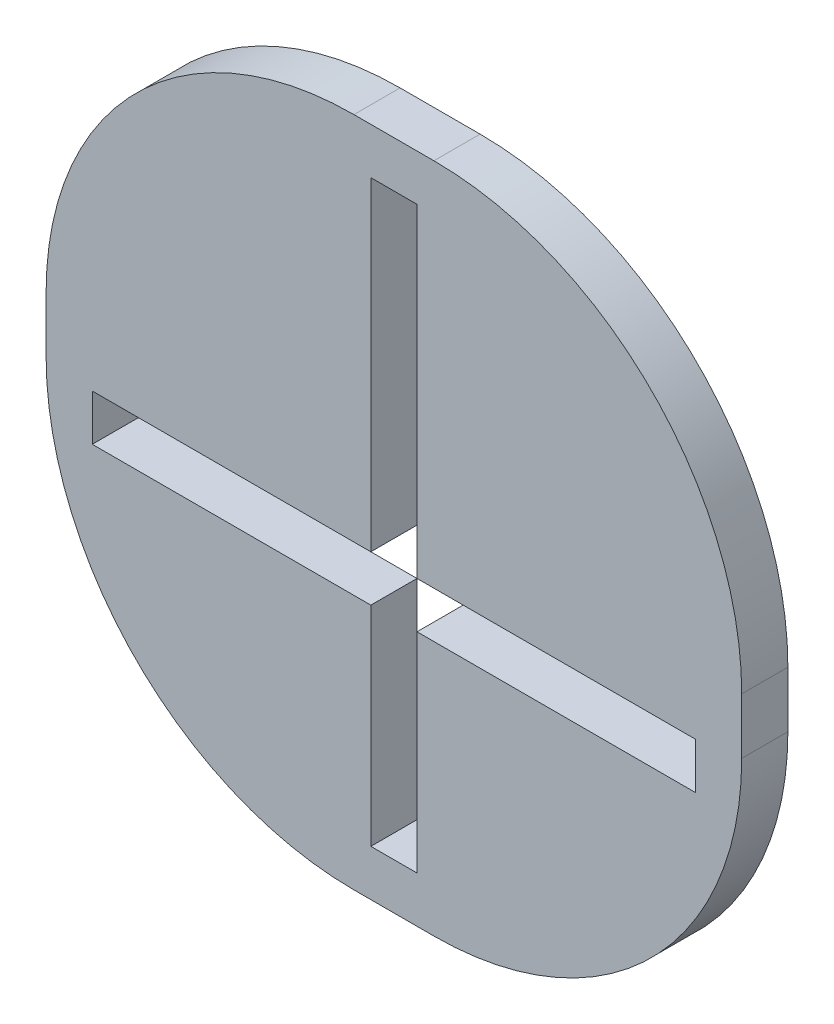
from build123d import *

# Parameters (mm, degrees)
SALIENTE_EXTRUIR1_DEPTH = 3


with BuildPart() as part:
    # Croquis1 → Saliente-Extruir1 (new body)
    with BuildSketch(Plane.XY):
        with BuildLine():
            Line((-2.6, -21.815), (2.6, -21.815))
            ThreePointArc((2.6, -21.815), (16.742135624, -15.957135624), (22.6, -1.815))
            Line((22.6, -1.815), (22.6, 1.815))
            ThreePointArc((22.6, 1.815), (16.742135624, 15.957135624), (2.6, 21.815))
            Line((2.6, 21.815), (-2.6, 21.815))
            ThreePointArc((-2.6, 21.815), (-16.742135624, 15.957135624), (-22.6, 1.815))
            Line((-22.6, 1.815), (-22.6, -1.815))
            ThreePointArc((-22.6, -1.815), (-16.742135624, -15.957135624), (-2.6, -21.815))
        make_face()
        Polygon((-19.6, -5.24), (-19.6, -2.24), (-1.5, -2.24), (-1.5, 18.815), (1.5, 18.815), (1.5, -2.24), (19.6, -2.24), (19.6, -5.24), (1.5, -5.24), (1.5, -18.815), (-1.5, -18.815), (-1.5, -5.24), align=None, mode=Mode.SUBTRACT)
    extrude(amount=SALIENTE_EXTRUIR1_DEPTH)


solid = part.part
